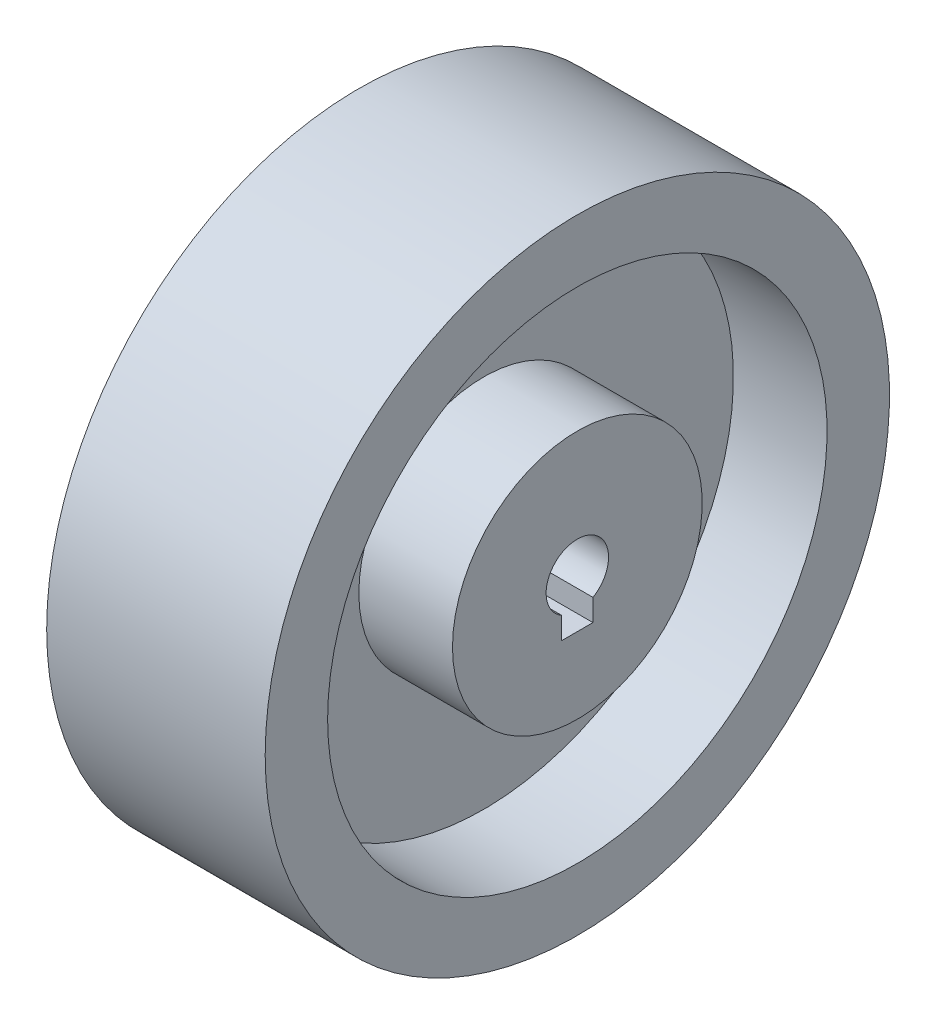
from build123d import *

# Parameters (mm, degrees)
CUT_EXTRUDE1_DEPTH = 79.89866919


with BuildPart() as part:
    # Sketch1 → Revolve1 (revolve)
    with BuildSketch(Plane.XY, mode=Mode.PRIVATE) as revolve1_sk:
        Polygon((-17.5, 5), (17.5, 5), (17.5, 20), (2.5, 20), (2.5, 40), (17.5, 40), (17.5, 50), (-17.5, 50), (-17.5, 40), (-2.5, 40), (-2.5, 20), (-17.5, 20), align=None)
    revolve(revolve1_sk.sketch.rotate(Axis((-17.5, 0, 0), (1, 0, 0)), 90), axis=Axis((-17.5, 0, 0), (1, 0, 0)))

    # Sketch2 → Cut-Extrude1 (cut, through all)
    with BuildSketch(Plane(origin=(17.5, 0, 0), x_dir=(0, 0, -1), z_dir=(1, 0, 0))):
        with BuildLine():
            Line((2.5, -4.330127019), (2.5, -7.830127019))
            Line((2.5, -7.830127019), (-2.5, -7.830127019))
            Line((-2.5, -7.830127019), (-2.5, -4.330127019))
            ThreePointArc((-2.5, -4.330127019), (0, -5), (2.5, -4.330127019))
        make_face()
    extrude(amount=-CUT_EXTRUDE1_DEPTH, mode=Mode.SUBTRACT)


solid = part.part
